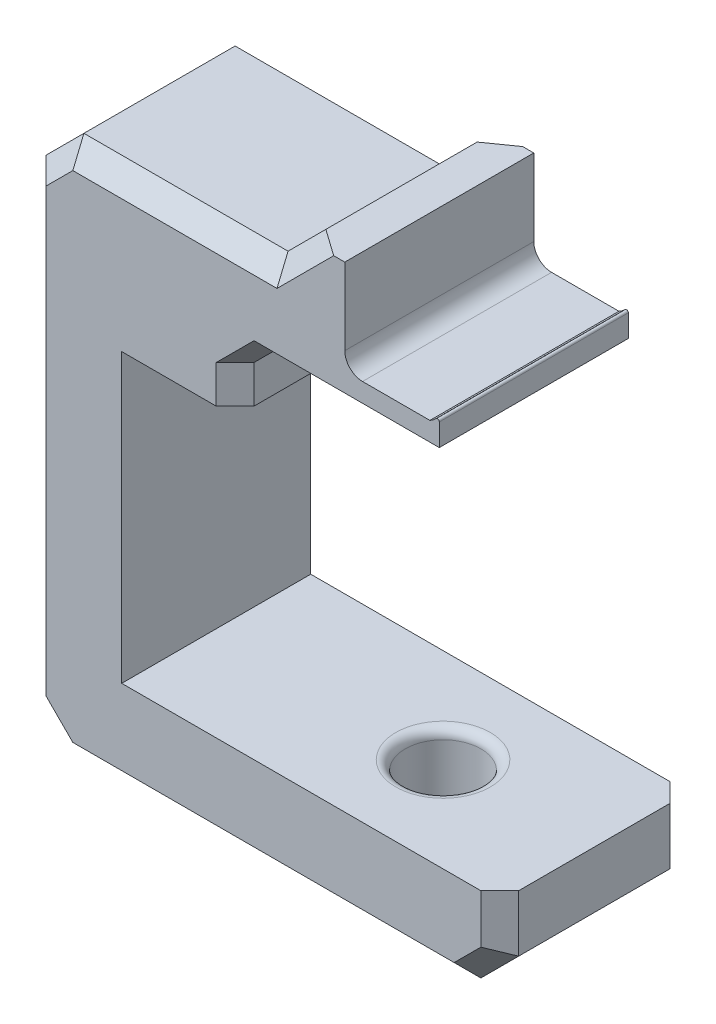
from build123d import *

# Parameters (mm, degrees)
RESSALTO_EXTRUS_O1_DEPTH = 10
ESBO_O3_R                = 2
CORTE_EXTRUS_O1_DEPTH    = 15
CHANFRO1_SIZE            = 1.6
FILETE1_R                = 0.5
FILETE2_R                = 0.94
RESSALTO_EXTRUS_O3_DEPTH = 10
CHANFRO5_SIZE            = 2
CHANFRO4_SIZE            = 1


with BuildPart() as part:
    # Esboço1 → Ressalto-extrusão1 (new body)
    with BuildSketch(Plane.XY):
        with BuildLine():
            Line((11, 14.25), (0.2, 14.25))
            Line((0.2, 14.25), (0.2, 11.25))
            Line((0.2, 11.25), (-5.8, 11.25))
            Line((-5.8, 11.25), (-5.8, -3.95))
            Line((-5.8, -3.95), (14.2, -3.95))
            Line((14.2, -3.95), (14.2, -8.95))
            Line((14.2, -8.95), (-10.8, -8.95))
            Line((-10.8, -8.95), (-10.8, 19.25))
            Line((-10.8, 19.25), (6, 19.25))
            Line((6, 19.25), (6, 16.25))
            Line((6, 16.25), (10.504380809, 16.25))
            ThreePointArc((10.504380809, 16.25), (10.676386068, 16.357306387), (10.826229508, 16.493861918))
            ThreePointArc((10.826229508, 16.493861918), (10.936214298, 16.519561844), (11, 16.426349589))
            Line((11, 16.426349589), (11, 16.25))
            Line((11, 16.25), (11, 14.25))
        make_face()
    extrude(amount=RESSALTO_EXTRUS_O1_DEPTH)

    # Esboço3 → Corte-extrusão1 (cut)
    with BuildSketch(Plane.XZ.offset(8.95)):
        with Locations(Location((6.2, 5, 0), (0, 0, 270))):
            Circle(ESBO_O3_R)
    extrude(amount=-CORTE_EXTRUS_O1_DEPTH, mode=Mode.SUBTRACT)

    # Chanfro1
    chanfro1_edges = [part.edges().sort_by_distance(p)[0] for p in [
        (6.2, -8.95, 7),
    ]]
    chamfer(chanfro1_edges, length=CHANFRO1_SIZE)

    # Filete1
    filete1_edges = [part.edges().sort_by_distance(p)[0] for p in [
        (6.2, -3.95, 7),
    ]]
    fillet(filete1_edges, radius=FILETE1_R)

    # Filete2
    filete2_edges = [part.edges().sort_by_distance(p)[0] for p in [
        (6, 16.25, 5),
    ]]
    fillet(filete2_edges, radius=FILETE2_R)

    # Esboço5 → Ressalto-extrusão3 (add)
    with BuildSketch(Plane.XY.offset(10)):
        Polygon((6, 19.25), (6, 21.25), (4, 21.25), (2, 19.25), align=None)
    extrude(amount=-RESSALTO_EXTRUS_O3_DEPTH)

    # Chanfro5
    chanfro5_edges = [part.edges().sort_by_distance(p)[0] for p in [
        (14.2, -8.95, 5),
        (-10.8, -8.95, 5),
        (-10.8, 19.25, 5),
    ]]
    chamfer(chanfro5_edges, length=CHANFRO5_SIZE)

    # Chanfro4
    chanfro4_edges = [part.edges().sort_by_distance(p)[0] for p in [
        (5.6, 14.25, 0),
        (0.2, 12.75, 0),
        (11, 14.25, 5),
        (0.2, 14.25, 5),
        (0.2, 12.75, 10),
        (-3.4, 19.25, 0),
        (-3.4, 19.25, 10),
        (3, 20.25, 10),
        (3, 20.25, 0),
        (14.2, -5.45, 0),
        (14.2, -5.45, 10),
        (1.7, -8.95, 0),
        (-10.8, 5.15, 0),
        (-9.8, 18.25, 0),
        (-9.8, -7.95, 0),
        (13.2, -7.95, 0),
        (1.7, -8.95, 10),
        (-10.8, 5.15, 10),
        (-9.8, 18.25, 10),
        (-9.8, -7.95, 10),
        (13.2, -7.95, 10),
        (5.6, 14.25, 10),
    ]]
    chamfer(chanfro4_edges, length=CHANFRO4_SIZE)


solid = part.part
